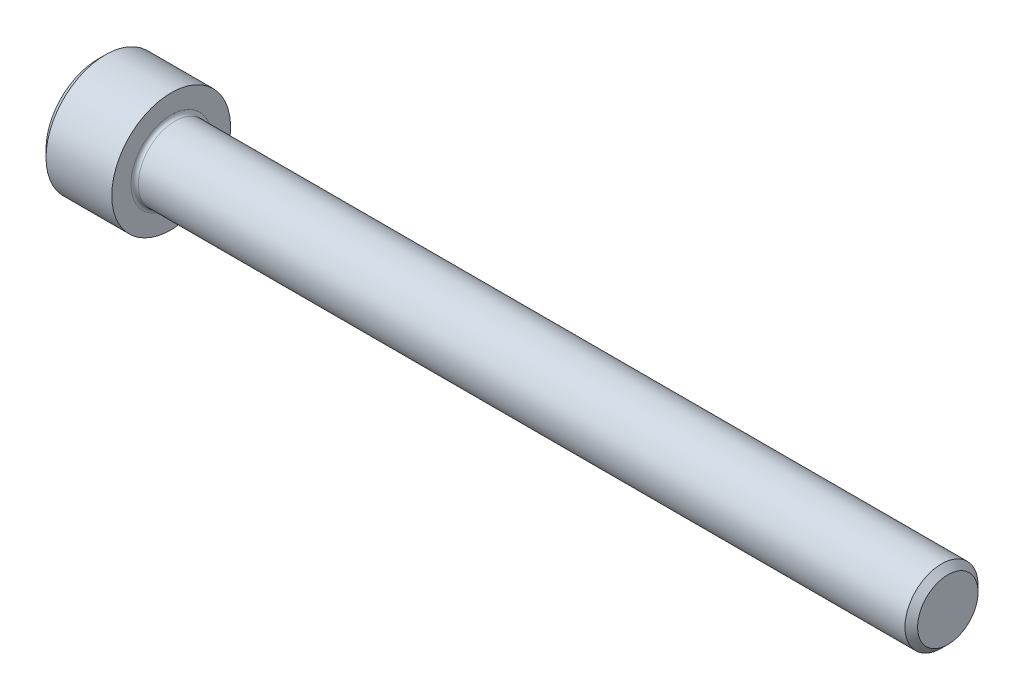
from build123d import *

# Parameters (mm, degrees)
FILLET1_R   = 0.4
HEX_2_DEPTH = 4


with BuildPart() as part:
    # BodySke → Base-Revolve (revolve)
    with BuildSketch(Plane.XY, mode=Mode.PRIVATE) as base_revolve_sk:
        Polygon((0, 0), (0, 5.7), (0.8, 6.5), (8, 6.5), (8, 4), (92.3095, 4), (93, 3.3095), (93, 0), align=None)
    revolve(base_revolve_sk.sketch.rotate(Axis((-31.75, 0, 0), (1, 0, 0)), 90), axis=Axis((-31.75, 0, 0), (1, 0, 0)))

    # Fillet1
    fillet1_edges = [part.edges().sort_by_distance(p)[0] for p in [
        (8, 0, -4),
    ]]
    fillet(fillet1_edges, radius=FILLET1_R)

    # Sketch2 → Hex-PreBroach (revolve, cut)
    with BuildSketch(Plane.XY, mode=Mode.PRIVATE) as hex_prebroach_sk:
        Polygon((0, 3.0475), (4, 3.0475), (5.759474945, 0), (0, 0), align=None)
    revolve(hex_prebroach_sk.sketch.rotate(Axis((0, 0, 0), (1, 0, 0)), 90), axis=Axis((0, 0, 0), (1, 0, 0)), mode=Mode.SUBTRACT)

    # Sketch3 → Hex 2 (cut)
    with BuildSketch(Plane(origin=(0, 0, 0), x_dir=(0, 0.500000000000001, 0.866025403784438), z_dir=(-1, 0, 0))):
        Polygon((1.759474945, 3.0475), (-1.759474945, 3.0475), (-3.518949891, 0), (-1.759474945, -3.0475), (1.759474945, -3.0475), (3.518949891, 0), align=None)
    extrude(amount=-HEX_2_DEPTH, mode=Mode.SUBTRACT)


solid = part.part
